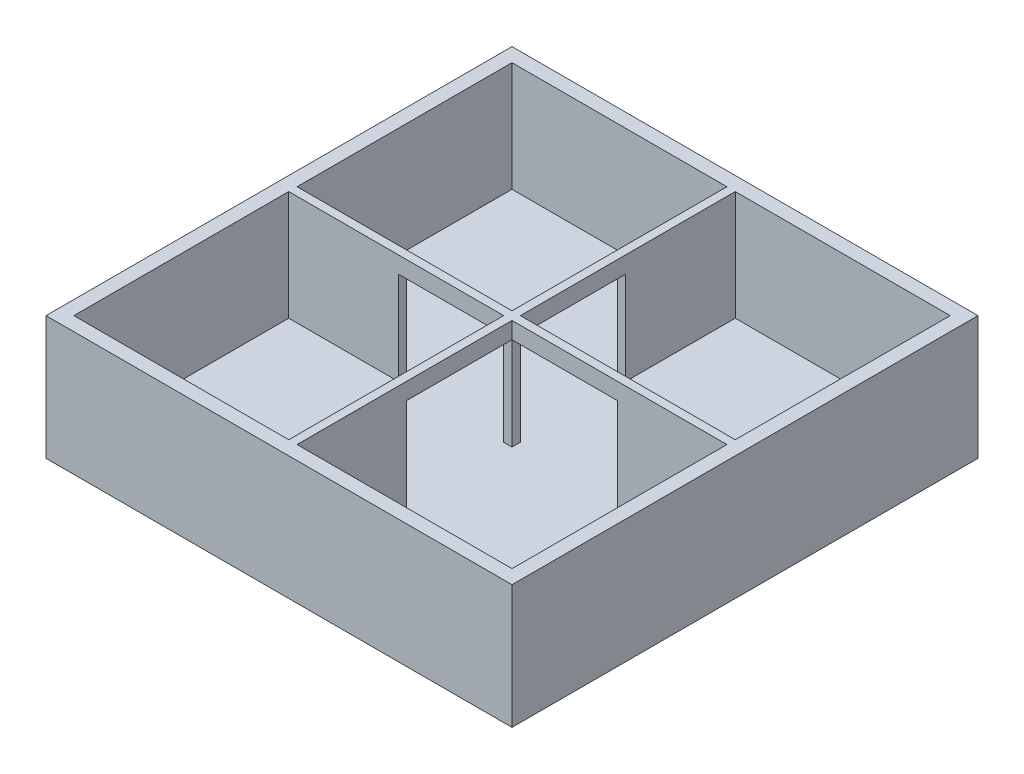
from build123d import *

# Parameters (mm, degrees)
BOSS_EXTRUDE1_DEPTH      = 2000.00616
BOSS_EXTRUDE1_DEPTH_BACK = 2.54
SKETCH2_W                = 8507.99416
SKETCH2_H                = 8507.99416
SKETCH2_W_2              = 7999.99416
SKETCH2_H_2              = 7999.99416
SKETCH4_W                = 8507.99416
SKETCH4_H                = 8507.99416
BOSS_EXTRUDE2_DEPTH      = 254
SKETCH8_W                = 3923.79708
SKETCH8_H                = 76.2
SKETCH8_W_2              = 76.2
SKETCH8_H_2              = 3923.79708
BOSS_EXTRUDE3_DEPTH      = 304.8
SKETCH12_W               = 152.4
SKETCH12_H               = 152.4
BOSS_EXTRUDE5_DEPTH      = 1697.74616
SKETCH14_W               = 1999.996
SKETCH14_H               = 152.4
SKETCH14_W_2             = 152.4
SKETCH14_H_2             = 1999.996
BOSS_EXTRUDE6_DEPTH      = 1697.74616


with BuildPart() as part:
    # Sketch2 → Boss-Extrude1 (new, two sides: drawn at the far end of the back side and taken through both)
    with BuildSketch(Plane(origin=(0, 0, 0), x_dir=(1, 0, 0), z_dir=(0, 1, 0)).offset(-BOSS_EXTRUDE1_DEPTH_BACK)):
        Rectangle(SKETCH2_W, SKETCH2_H)
        Rectangle(SKETCH2_W_2, SKETCH2_H_2, mode=Mode.SUBTRACT)
    extrude(amount=BOSS_EXTRUDE1_DEPTH + BOSS_EXTRUDE1_DEPTH_BACK)

    # Sketch4 → Boss-Extrude2 (add)
    with BuildSketch(Plane.XZ.offset(2.54)):
        Rectangle(SKETCH4_W, SKETCH4_H)
    extrude(amount=BOSS_EXTRUDE2_DEPTH)


with BuildPart() as body_2:
    # Sketch8 → Boss-Extrude3 (new body)
    with BuildSketch(Plane(origin=(0, 2000.00616, 0), x_dir=(1, 0, 0), z_dir=(0, 1, 0))):
        with Locations((-2038.09854, 38.1)):
            Rectangle(SKETCH8_W, SKETCH8_H)
        with Locations((-2038.09854, -38.1)):
            Rectangle(SKETCH8_W, SKETCH8_H)
        with Locations((-38.1, -38.1)):
            Rectangle(SKETCH8_W_2, SKETCH8_H)
        with Locations((-38.1, 2038.09854)):
            Rectangle(SKETCH8_W_2, SKETCH8_H_2)
        with Locations((38.1, 2038.09854)):
            Rectangle(SKETCH8_W_2, SKETCH8_H_2)
        with Locations((2038.09854, 38.1)):
            Rectangle(SKETCH8_W, SKETCH8_H)
        with Locations((2038.09854, -38.1)):
            Rectangle(SKETCH8_W, SKETCH8_H)
        with Locations((38.1, -2038.09854)):
            Rectangle(SKETCH8_W_2, SKETCH8_H_2)
        with Locations((-38.1, -2038.09854)):
            Rectangle(SKETCH8_W_2, SKETCH8_H_2)
        with Locations((38.1, -38.1)):
            Rectangle(SKETCH8_W_2, SKETCH8_H)
        with Locations((38.1, 38.1)):
            Rectangle(SKETCH8_W_2, SKETCH8_H)
        with Locations((-38.1, 38.1)):
            Rectangle(SKETCH8_W_2, SKETCH8_H)
    extrude(amount=-BOSS_EXTRUDE3_DEPTH)

    # Combine1: union part
    add(part.part)

    # Sketch12 → Boss-Extrude5 (add)
    with BuildSketch(Plane(origin=(0, -2.54, 0), x_dir=(1, 0, 0), z_dir=(0, 1, 0))):
        Rectangle(SKETCH12_W, SKETCH12_H)
    extrude(amount=BOSS_EXTRUDE5_DEPTH)

    # Sketch14 → Boss-Extrude6 (add)
    with BuildSketch(Plane(origin=(0, -2.54, 0), x_dir=(1, 0, 0), z_dir=(0, 1, 0))):
        with Locations((-2999.99908, 0)):
            Rectangle(SKETCH14_W, SKETCH14_H)
        with Locations((0, 2999.99908)):
            Rectangle(SKETCH14_W_2, SKETCH14_H_2)
        with Locations((2999.99908, 0)):
            Rectangle(SKETCH14_W, SKETCH14_H)
        with Locations((0, -2999.99908)):
            Rectangle(SKETCH14_W_2, SKETCH14_H_2)
    extrude(amount=BOSS_EXTRUDE6_DEPTH)


solid = body_2.part
